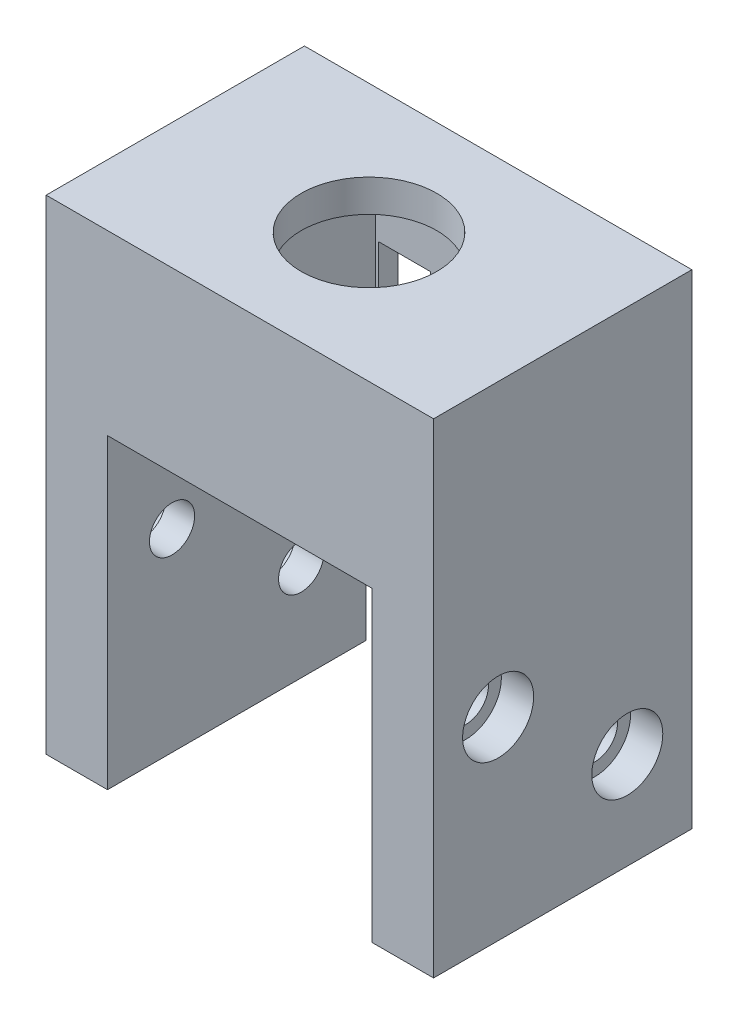
from build123d import *

# Parameters (mm, degrees)
SKETCH_1_W          = 8.2
SKETCH_1_H          = 8
SKETCH_1_R          = 2.1
EXTRUDE_1_DEPTH     = 1
EXTRUDE_START       = 1
SKETCH_1_6_W        = 1.9
SKETCH_1_6_H        = 8
EXTRUDE_2_DEPTH     = 15
EXTRUDE_2_2_DEPTH   = 15
SKETCH_2_W          = 0.9
SKETCH_2_H          = 0.6
SKETCH_2_W_2        = 6.4
SKETCH_2_H_2        = 6.8
EXTRUDE_3_DEPTH     = 4.5
CUT_EXTRUDE_1_REACH = 19.205
SKETCH_3_W          = 1.6
SKETCH_3_H          = 2
SKETCH_4_R          = 0.7
CUT_EXTRUDE_2_DEPTH = 19.867962264
SKETCH_4_3_R        = 1.1
CUT_EXTRUDE_3_DEPTH = 1
CUT_EXTRUDE_START   = -11
SKETCH_4_4_R        = 1.1
CUT_EXTRUDE_4_DEPTH = 1


with BuildPart() as part:
    # 草图1 → 凸台-拉伸1 (new body)
    with BuildSketch(Plane(origin=(0, 0, 0), x_dir=(1, 0, 0), z_dir=(0, 1, 0))):
        Rectangle(SKETCH_1_W, SKETCH_1_H)
        with Locations(Location((0, 0, 0), (0, 0, 270))):
            Circle(SKETCH_1_R, mode=Mode.SUBTRACT)
    extrude(amount=EXTRUDE_1_DEPTH)



with BuildPart() as body_2:
    # 草图1<6> → 凸台-拉伸2 (new body)
    with BuildSketch(Plane(origin=(0, 0, 0), x_dir=(1, 0, 0), z_dir=(0, 1, 0)).offset(EXTRUDE_START)):
        with Locations((-5.05, 0)):
            Rectangle(SKETCH_1_6_W, SKETCH_1_6_H)
    extrude(amount=-EXTRUDE_2_DEPTH)


with BuildPart() as body_3:
    # 草图1<6> → Extrude 2 2 (new body)
    with BuildSketch(Plane(origin=(0, 0, 0), x_dir=(1, 0, 0), z_dir=(0, 1, 0)).offset(EXTRUDE_START)):
        with Locations((5.05, 0)):
            Rectangle(SKETCH_1_6_W, SKETCH_1_6_H)
    extrude(amount=-EXTRUDE_2_2_DEPTH)


with BuildPart() as part_1:
    add(part.part)

    add(body_2.part)  # 凸台-拉伸3 merges body 2

    add(body_3.part)  # 凸台-拉伸3 merges body 3
    # 草图2 → 凸台-拉伸3 (add)
    with BuildSketch(Plane.XZ):
        with Locations((-3.65, 3.7)):
            Rectangle(SKETCH_2_W, SKETCH_2_H)
        with Locations((0, 3.7)):
            Rectangle(SKETCH_2_W_2, SKETCH_2_H)
        with Locations((3.65, 3.7)):
            Rectangle(SKETCH_2_W, SKETCH_2_H)
        with Locations((3.65, 0)):
            Rectangle(SKETCH_2_W, SKETCH_2_H_2)
        with Locations((3.65, -3.7)):
            Rectangle(SKETCH_2_W, SKETCH_2_H)
        with Locations((0, -3.7)):
            Rectangle(SKETCH_2_W_2, SKETCH_2_H)
        with Locations((-3.65, -3.7)):
            Rectangle(SKETCH_2_W, SKETCH_2_H)
        with Locations((-3.65, 0)):
            Rectangle(SKETCH_2_W, SKETCH_2_H_2)
    extrude(amount=EXTRUDE_3_DEPTH)

    # 草图3 → 切除-拉伸1 (cut, up to next)
    with BuildSketch(Plane(origin=(0, 0, -4), x_dir=(-1, 0, 0), z_dir=(0, 0, -1)), mode=Mode.PRIVATE) as cut_extrude_1_sk1:
        with Locations((-2.3, -3.5)):
            Rectangle(SKETCH_3_W, SKETCH_3_H)
    cut_extrude_1_tool1 = extrude(cut_extrude_1_sk1.sketch, amount=-CUT_EXTRUDE_1_REACH, mode=Mode.PRIVATE) & part_1.part
    # 草图3 → 切除-拉伸1 (cut, up to next)
    with BuildSketch(Plane(origin=(0, 0, -4), x_dir=(-1, 0, 0), z_dir=(0, 0, -1)), mode=Mode.PRIVATE) as cut_extrude_1_sk2:
        with Locations((2.3, -3.5)):
            Rectangle(SKETCH_3_W, SKETCH_3_H)
    cut_extrude_1_tool2 = extrude(cut_extrude_1_sk2.sketch, amount=-CUT_EXTRUDE_1_REACH, mode=Mode.PRIVATE) & part_1.part
    add(cut_extrude_1_tool1.solids().sort_by_distance((2.3, -3.5, -4))[0], mode=Mode.SUBTRACT)
    add(cut_extrude_1_tool2.solids().sort_by_distance((-2.3, -3.5, -4))[0], mode=Mode.SUBTRACT)

    # 草图4 → 切除-拉伸2 (cut, through all)
    with BuildSketch(Plane(origin=(6, 0, 0), x_dir=(0, 0, -1), z_dir=(1, 0, 0))):
        with Locations((-2, -8)):
            Circle(SKETCH_4_R)
        with Locations((2, -11)):
            Circle(SKETCH_4_R)
    extrude(amount=-CUT_EXTRUDE_2_DEPTH, mode=Mode.SUBTRACT)

    # 草图4<3> → 切除-拉伸3 (cut)
    with BuildSketch(Plane(origin=(6, 0, 0), x_dir=(0, 0, -1), z_dir=(1, 0, 0))):
        with Locations((-2, -8)):
            Circle(SKETCH_4_3_R)
        with Locations((2, -11)):
            Circle(SKETCH_4_3_R)
    extrude(amount=-CUT_EXTRUDE_3_DEPTH, mode=Mode.SUBTRACT)

    # 草图4<4> → 切除-拉伸4 (cut)
    with BuildSketch(Plane(origin=(6, 0, 0), x_dir=(0, 0, -1), z_dir=(1, 0, 0)).offset(CUT_EXTRUDE_START)):
        with Locations((-2, -8)):
            Circle(SKETCH_4_4_R)
        with Locations((2, -11)):
            Circle(SKETCH_4_4_R)
    extrude(amount=-CUT_EXTRUDE_4_DEPTH, mode=Mode.SUBTRACT)


solid = part_1.part
